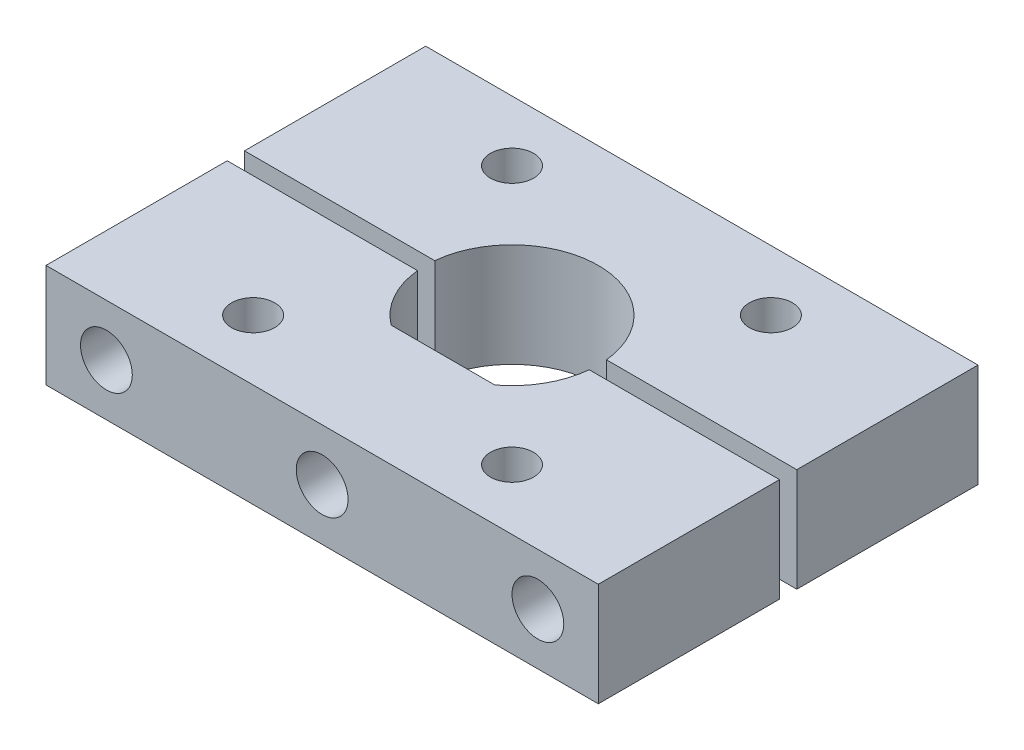
from build123d import *

# Parameters (mm, degrees)
EXTRUDE_1_DEPTH             = 3
EXTRUDE_1_2_DEPTH           = 3
SKETCH_3_W                  = 1.25
SKETCH_3_H                  = 22
HOLE_WIZARD_M3_1_AT_2_COUNT = 2
HOLE_WIZARD_M3_1_AT_2_PITCH = 25
SKETCH_5_W                  = 1.25
SKETCH_5_H                  = 6
HOLE_WIZARD_M3_2_AT_2_COUNT = 2
HOLE_WIZARD_M3_2_AT_2_PITCH = 15
HOLE_WIZARD_M3_2_AT_3_COUNT = 2
HOLE_WIZARD_M3_2_AT_3_PITCH = 15
HOLE_WIZARD_M3_2_AT_4_COUNT = 2
HOLE_WIZARD_M3_2_AT_4_PITCH = 21.213203436
SKETCH_6_R                  = 1.5
CUT_EXTRUDE_1_DEPTH         = 28.367864367


with BuildPart() as part:
    # 草图1 → 凸台-拉伸1 (new, symmetric)
    with BuildSketch(Plane(origin=(0, 0, 0), x_dir=(1, 0, 0), z_dir=(0, 1, 0))):
        with BuildLine():
            Line((-3, -4), (3, -4))
            ThreePointArc((3, -4), (4.354584455, -2.457151648), (4.974937186, -0.5))
            Line((4.974937186, -0.5), (16, -0.5))
            Line((16, -0.5), (16, -11))
            Line((16, -11), (-16, -11))
            Line((-16, -11), (-16, -0.5))
            Line((-16, -0.5), (-4.974937186, -0.5))
            ThreePointArc((-4.974937186, -0.5), (-4.354584455, -2.457151648), (-3, -4))
        make_face()
    extrude(amount=EXTRUDE_1_DEPTH, both=True)


with BuildPart() as body_2:
    # 草图1 → Extrude 1 2 (new, symmetric)
    with BuildSketch(Plane(origin=(0, 0, 0), x_dir=(1, 0, 0), z_dir=(0, 1, 0))):
        with BuildLine():
            Line((-16, 11), (16, 11))
            Line((16, 11), (16, 0.5))
            Line((16, 0.5), (4.974937186, 0.5))
            ThreePointArc((4.974937186, 0.5), (0, 5), (-4.974937186, 0.5))
            Line((-4.974937186, 0.5), (-16, 0.5))
            Line((-16, 0.5), (-16, 11))
        make_face()
    extrude(amount=EXTRUDE_1_2_DEPTH, both=True)


with BuildPart() as hole_wizard_m3_1_tool:
    # 草图3 → M3 螺纹孔1 (revolve)
    with BuildSketch(Plane(origin=(-12.5, 0, 11), x_dir=(0, -1, 0), z_dir=(1, 0, 0))):
        with Locations((0.625, 11)):
            Rectangle(SKETCH_3_W, SKETCH_3_H)
    hole_wizard_m3_1 = revolve(axis=Axis((-12.5, 0, 17.35), (0, 0, -1)))


with BuildPart() as part_1:
    add(part.part)

    # M3 螺纹孔1: cut by hole_wizard_m3_1_tool
    add(hole_wizard_m3_1_tool.part, mode=Mode.SUBTRACT)


with BuildPart() as body_2_1:
    add(body_2.part)

    # M3 螺纹孔1: cut by hole_wizard_m3_1_tool
    add(hole_wizard_m3_1_tool.part, mode=Mode.SUBTRACT)


with BuildPart() as hole_wizard_m3_1_at_2_tool:
    # M3 螺纹孔1 at 2: M3 螺纹孔1 ×2
    with Locations(*[(i * HOLE_WIZARD_M3_1_AT_2_PITCH, 0, 0) for i in range(1, HOLE_WIZARD_M3_1_AT_2_COUNT)]):
        add(hole_wizard_m3_1)


with BuildPart() as part_2:
    add(part_1.part)

    # M3 螺纹孔1 at 2: cut by hole_wizard_m3_1_at_2_tool
    add(hole_wizard_m3_1_at_2_tool.part, mode=Mode.SUBTRACT)


with BuildPart() as body_2_2:
    add(body_2_1.part)

    # M3 螺纹孔1 at 2: cut by hole_wizard_m3_1_at_2_tool
    add(hole_wizard_m3_1_at_2_tool.part, mode=Mode.SUBTRACT)

    # 草图5 → M3 螺纹孔2 (revolve, cut)
    with BuildSketch(Plane(origin=(-7.5, 3, -7.5), x_dir=(0, 0, 1), z_dir=(1, 0, 0))):
        with Locations((0.625, 3)):
            Rectangle(SKETCH_5_W, SKETCH_5_H)
    hole_wizard_m3_2 = revolve(axis=Axis((-7.5, 9.35, -7.5), (0, -1, 0)), mode=Mode.SUBTRACT)

    # M3 螺纹孔2 at 2: M3 螺纹孔2 ×2
    with Locations(*[(i * HOLE_WIZARD_M3_2_AT_2_PITCH, 0, 0) for i in range(1, HOLE_WIZARD_M3_2_AT_2_COUNT)]):
        add(hole_wizard_m3_2, mode=Mode.SUBTRACT)


with BuildPart() as part_3:
    add(part_2.part)

    # M3 螺纹孔2 at 3: M3 螺纹孔2 ×2
    with Locations(*[(0, 0, i * HOLE_WIZARD_M3_2_AT_3_PITCH) for i in range(1, HOLE_WIZARD_M3_2_AT_3_COUNT)]):
        add(hole_wizard_m3_2, mode=Mode.SUBTRACT)

    # M3 螺纹孔2 at 4: M3 螺纹孔2 ×2
    with Locations(*[Vector(0.7071067811865477, 0, 0.7071067811865475) * (i * HOLE_WIZARD_M3_2_AT_4_PITCH) for i in range(1, HOLE_WIZARD_M3_2_AT_4_COUNT)]):
        add(hole_wizard_m3_2, mode=Mode.SUBTRACT)

    # 草图6 → 切除-拉伸1 (cut, through all)
    with BuildSketch(Plane.XY.offset(11)):
        Circle(SKETCH_6_R)
        with Locations((-12.5, 0)):
            Circle(SKETCH_6_R)
        with Locations((12.5, 0)):
            Circle(SKETCH_6_R)
    extrude(amount=-CUT_EXTRUDE_1_DEPTH, mode=Mode.SUBTRACT)


solid = Compound([body_2_2.part, part_3.part])
